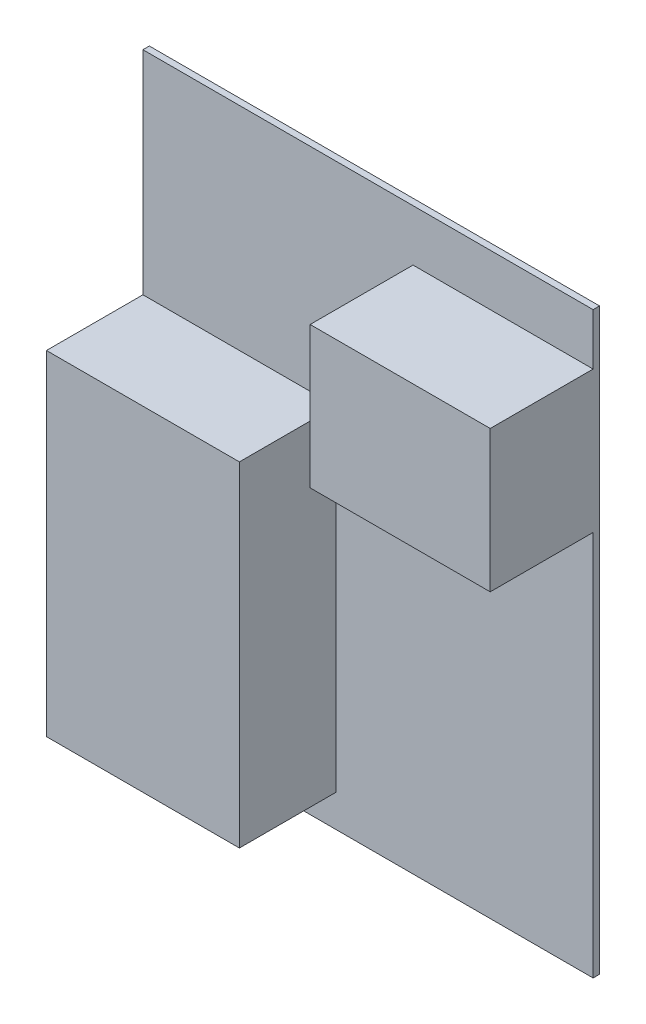
from build123d import *

# Parameters (mm, degrees)
SKETCH2_W           = 70
SKETCH2_H           = 90
BOSS_EXTRUDE1_DEPTH = 1
SKETCH3_W           = 28
SKETCH3_H           = 22
BOSS_EXTRUDE2_DEPTH = 16
SKETCH4_W           = 30
SKETCH4_H           = 52
BOSS_EXTRUDE3_DEPTH = 15


with BuildPart() as part:
    # Sketch2 → Boss-Extrude1 (new body)
    with BuildSketch(Plane.XY):
        Rectangle(SKETCH2_W, SKETCH2_H)
    extrude(amount=BOSS_EXTRUDE1_DEPTH)

    # Sketch3 → Boss-Extrude2 (add)
    with BuildSketch(Plane.XY.offset(1)):
        with Locations((21, 26)):
            Rectangle(SKETCH3_W, SKETCH3_H)
    extrude(amount=BOSS_EXTRUDE2_DEPTH)

    # Sketch4 → Boss-Extrude3 (add)
    with BuildSketch(Plane.XY.offset(1)):
        with Locations((-20, -14)):
            Rectangle(SKETCH4_W, SKETCH4_H)
    extrude(amount=BOSS_EXTRUDE3_DEPTH)


solid = part.part
